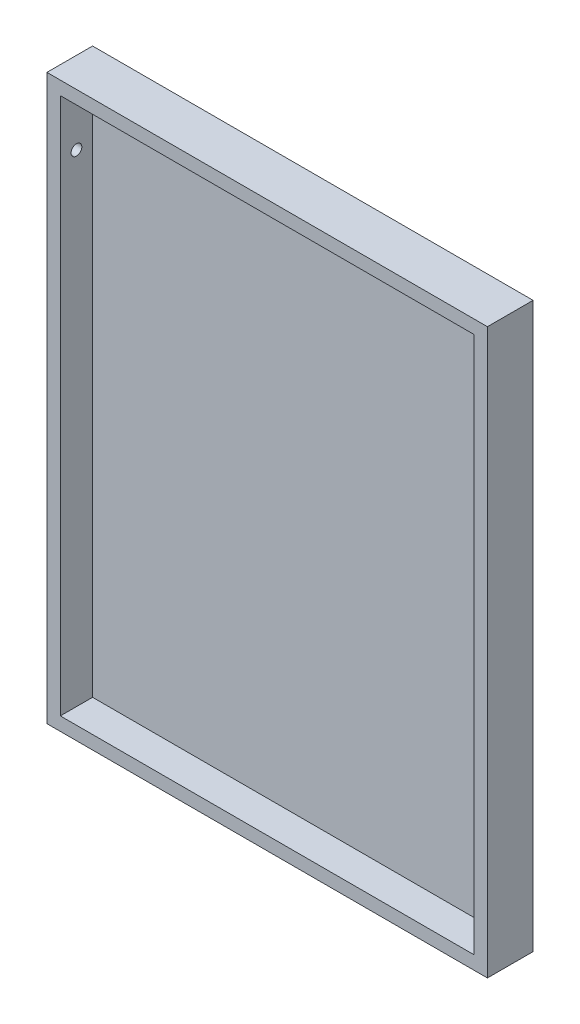
from build123d import *

# Parameters (mm, degrees)
SKETCH1_W           = 210
SKETCH1_H           = 164
BOSS_EXTRUDE1_DEPTH = 5
SKETCH2_W           = 164
SKETCH2_H           = 210
SKETCH2_W_2         = 154
SKETCH2_H_2         = 200
BOSS_EXTRUDE2_DEPTH = 12
SKETCH3_R           = 2
CUT_EXTRUDE1_DEPTH  = 159


with BuildPart() as part:
    # Sketch1 → Boss-Extrude1 (new body)
    with BuildSketch(Plane(origin=(0, 0, 0), x_dir=(0, 1, 0), z_dir=(0, 0, 1))):
        Rectangle(SKETCH1_W, SKETCH1_H)
    extrude(amount=BOSS_EXTRUDE1_DEPTH)

    # Sketch2 → Boss-Extrude2 (add)
    with BuildSketch(Plane.XY.offset(5)):
        Rectangle(SKETCH2_W, SKETCH2_H)
        Rectangle(SKETCH2_W_2, SKETCH2_H_2, mode=Mode.SUBTRACT)
    extrude(amount=BOSS_EXTRUDE2_DEPTH)

    # Sketch3 → Cut-Extrude1 (cut)
    with BuildSketch(Plane(origin=(77, 0, 0), x_dir=(0, -1, 0), z_dir=(-1, 0, 0))):
        with Locations(Location((-79.5, 11, 0), (0, 0, 270))):
            Circle(SKETCH3_R)
    extrude(amount=CUT_EXTRUDE1_DEPTH, mode=Mode.SUBTRACT)


solid = part.part
